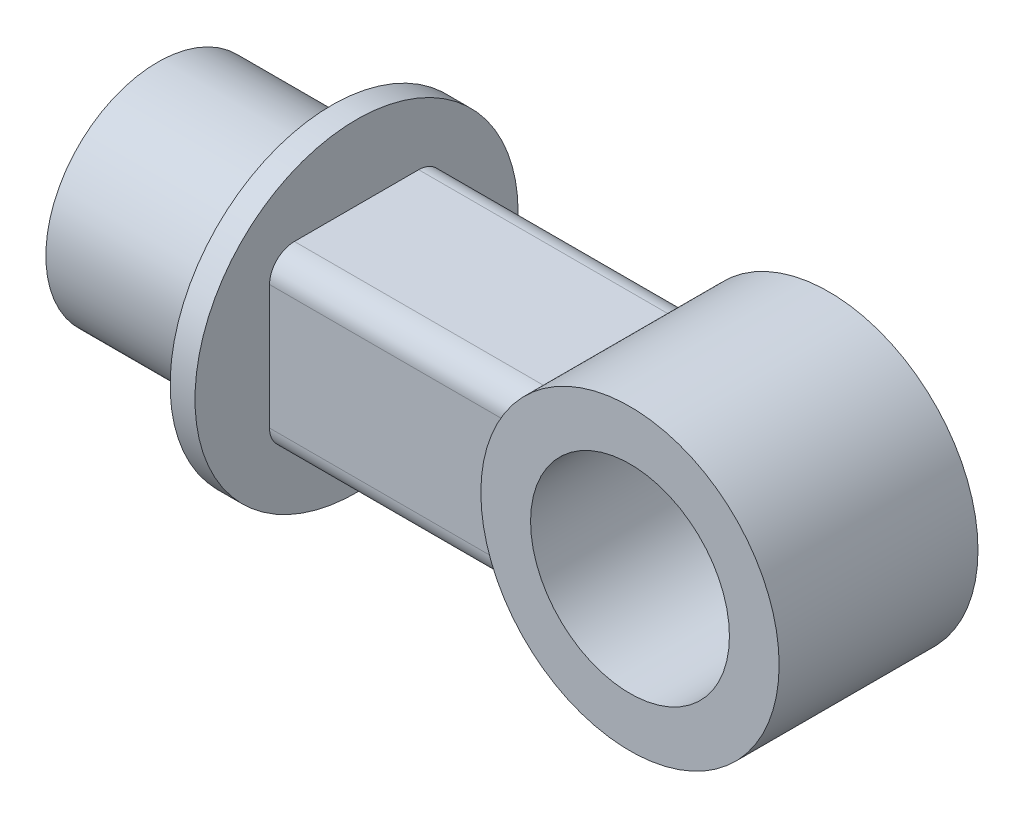
from build123d import *

# Parameters (mm, degrees)
SKETCH1_R           = 45
BOSS_EXTRUDE1_DEPTH = 70
SKETCH2_R           = 65
BOSS_EXTRUDE2_DEPTH = 10
SKETCH3_R           = 60
SKETCH3_R_2         = 40
BOSS_EXTRUDE3_DEPTH = 40
SKETCH4_W           = 70
SKETCH4_H           = 70
BOSS_EXTRUDE4_DEPTH = 110
FILLET1_R           = 10


with BuildPart() as part:
    # Sketch1 → Boss-Extrude1 (new body)
    with BuildSketch(Plane(origin=(0, 0, 0), x_dir=(0, 0, -1), z_dir=(1, 0, 0))):
        Circle(SKETCH1_R)
    extrude(amount=BOSS_EXTRUDE1_DEPTH)

    # Sketch2 → Boss-Extrude2 (add)
    with BuildSketch(Plane(origin=(70, 0, 0), x_dir=(0, 0, -1), z_dir=(1, 0, 0))):
        Circle(SKETCH2_R)
    extrude(amount=BOSS_EXTRUDE2_DEPTH)



with BuildPart() as body_2:
    # Sketch3 → Boss-Extrude3 (new, symmetric)
    with BuildSketch(Plane.XY):
        with Locations((230, 0)):
            Circle(SKETCH3_R)
        with Locations((230, 0)):
            Circle(SKETCH3_R_2, mode=Mode.SUBTRACT)
    extrude(amount=BOSS_EXTRUDE3_DEPTH, both=True)


with BuildPart() as part_1:
    add(part.part)

    add(body_2.part)  # Boss-Extrude4 merges body 2
    # Sketch4 → Boss-Extrude4 (add)
    with BuildSketch(Plane(origin=(80, 0, 0), x_dir=(0, 0, -1), z_dir=(1, 0, 0))):
        Rectangle(SKETCH4_W, SKETCH4_H)
    extrude(amount=BOSS_EXTRUDE4_DEPTH)

    # Fillet1
    fillet1_edges = [part_1.edges().sort_by_distance(p)[0] for p in [
        (130.633014138, -35, -35),
        (130.633014138, -35, 35),
        (130.633014138, 35, 35),
        (130.633014138, 35, -35),
    ]]
    fillet(fillet1_edges, radius=FILLET1_R)


solid = part_1.part
